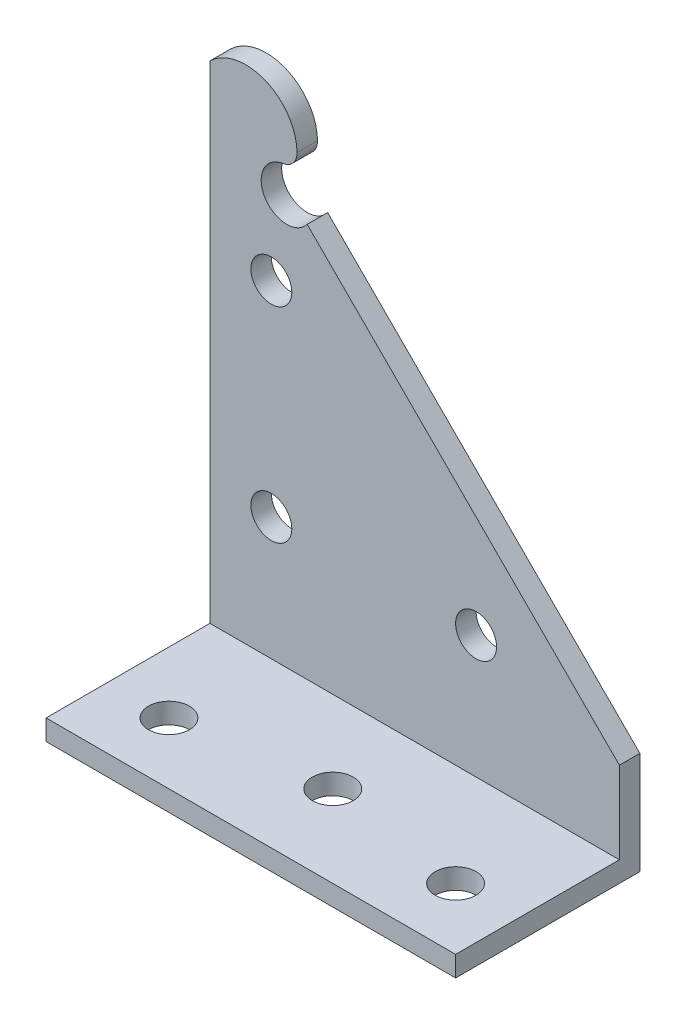
from build123d import *

# Parameters (mm, degrees)
SKETCH1_R               = 3.175
BOSS_EXTRUDE1_DEPTH     = 3.175
SKETCH2_W               = 63.5
SKETCH2_H               = 3.175
BOSS_EXTRUDE2_DEPTH     = 25.4
CUT_EXTRUDE1_DEPTH      = 105.410975214
CUT_EXTRUDE1_DEPTH_BACK = 105.410975214
SKETCH3_R               = 3.175


with BuildPart() as part:
    # Sketch1 → Boss-Extrude1 (new body)
    with BuildSketch(Plane.XY):
        with BuildLine():
            Line((0, 78.705067014), (0, 0))
            Line((0, 0), (63.5, 0))
            Line((63.5, 0), (63.5, 15.875))
            Line((63.5, 15.875), (15.080341671, 64.294658329))
            ThreePointArc((15.080341671, 64.294658329), (8.505408108, 64.65221549), (11.339511683, 70.595737627))
            ThreePointArc((11.339511683, 70.595737627), (12.906539417, 71.462906002), (13.511840983, 73.148482141))
            ThreePointArc((13.511840983, 73.148482141), (8.586326617, 80.377738088), (0, 78.705067014))
        make_face()
        with Locations((9.525, 22.225)):
            Circle(SKETCH1_R, mode=Mode.SUBTRACT)
        with Locations((41.275, 22.225)):
            Circle(SKETCH1_R, mode=Mode.SUBTRACT)
        with Locations((9.525, 53.975)):
            Circle(SKETCH1_R, mode=Mode.SUBTRACT)
    extrude(amount=BOSS_EXTRUDE1_DEPTH)

    # Sketch2 → Boss-Extrude2 (add)
    with BuildSketch(Plane.XY.offset(3.175)):
        with Locations((31.75, 1.5875)):
            Rectangle(SKETCH2_W, SKETCH2_H)
    extrude(amount=BOSS_EXTRUDE2_DEPTH)

    # Sketch3 → Cut-Extrude1 (cut, two sides: drawn at the far end of the back side and taken through both)
    with BuildSketch(Plane(origin=(0, 3.175, 0), x_dir=(1, 0, 0), z_dir=(0, 1, 0)).offset(-CUT_EXTRUDE1_DEPTH_BACK)):
        with Locations(Location((9.525, -19.05, 0), (0, 0, 270))):
            Circle(SKETCH3_R)
        with Locations(Location((53.975, -19.05, 0), (0, 0, 270))):
            Circle(SKETCH3_R)
        with Locations(Location((31.75, -15.875, 0), (0, 0, 270))):
            Circle(SKETCH3_R)
    extrude(amount=CUT_EXTRUDE1_DEPTH + CUT_EXTRUDE1_DEPTH_BACK, mode=Mode.SUBTRACT)


solid = part.part
